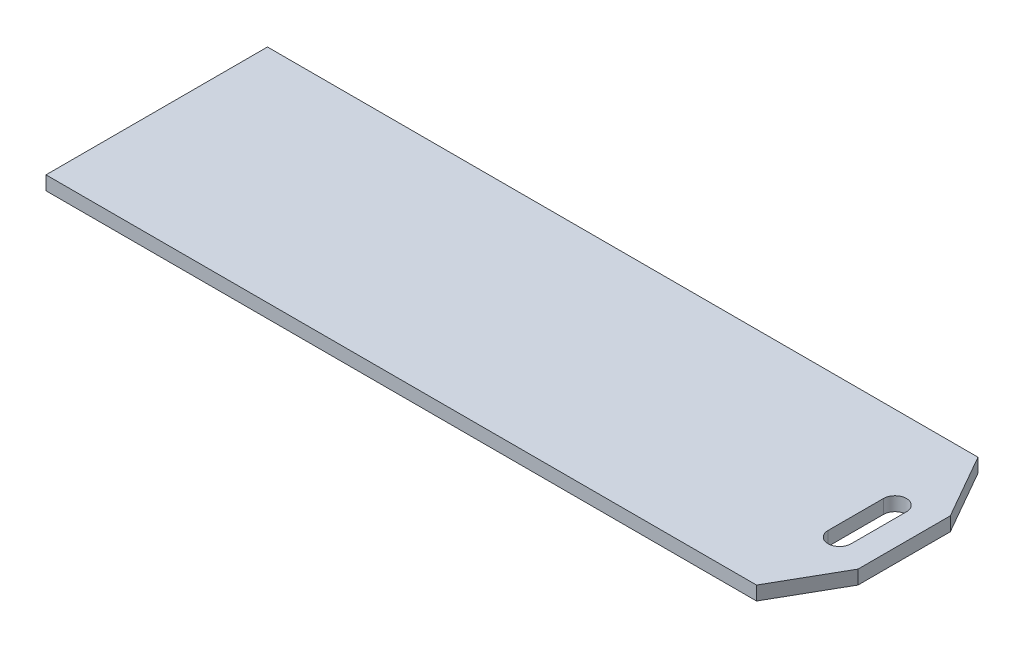
from build123d import *

# Parameters (mm, degrees)
BOSS_EXTRUDE1_DEPTH = 19.05
CUT_EXTRUDE1_DEPTH  = 19.05


with BuildPart() as part:
    # Sketch1 → Boss-Extrude1 (new body)
    with BuildSketch(Plane(origin=(0, 0, 0), x_dir=(1, 0, 0), z_dir=(0, 1, 0))):
        Polygon((0, 0), (977.9, 0), (1028.7, -88.9), (1028.7, -215.9), (977.9, -304.8), (0, -304.8), align=None)
    extrude(amount=BOSS_EXTRUDE1_DEPTH)

    # Sketch2 → Cut-Extrude1 (cut)
    with BuildSketch(Plane(origin=(0, 19.05, 0), x_dir=(1, 0, 0), z_dir=(0, 1, 0))):
        with BuildLine():
            Line((993.775, -114.3), (993.775, -190.5))
            ThreePointArc((993.775, -190.5), (977.9, -206.375), (962.025, -190.5))
            Line((962.025, -190.5), (962.025, -114.3))
            ThreePointArc((962.025, -114.3), (977.9, -98.425), (993.775, -114.3))
        make_face()
    extrude(amount=-CUT_EXTRUDE1_DEPTH, mode=Mode.SUBTRACT)


solid = part.part
